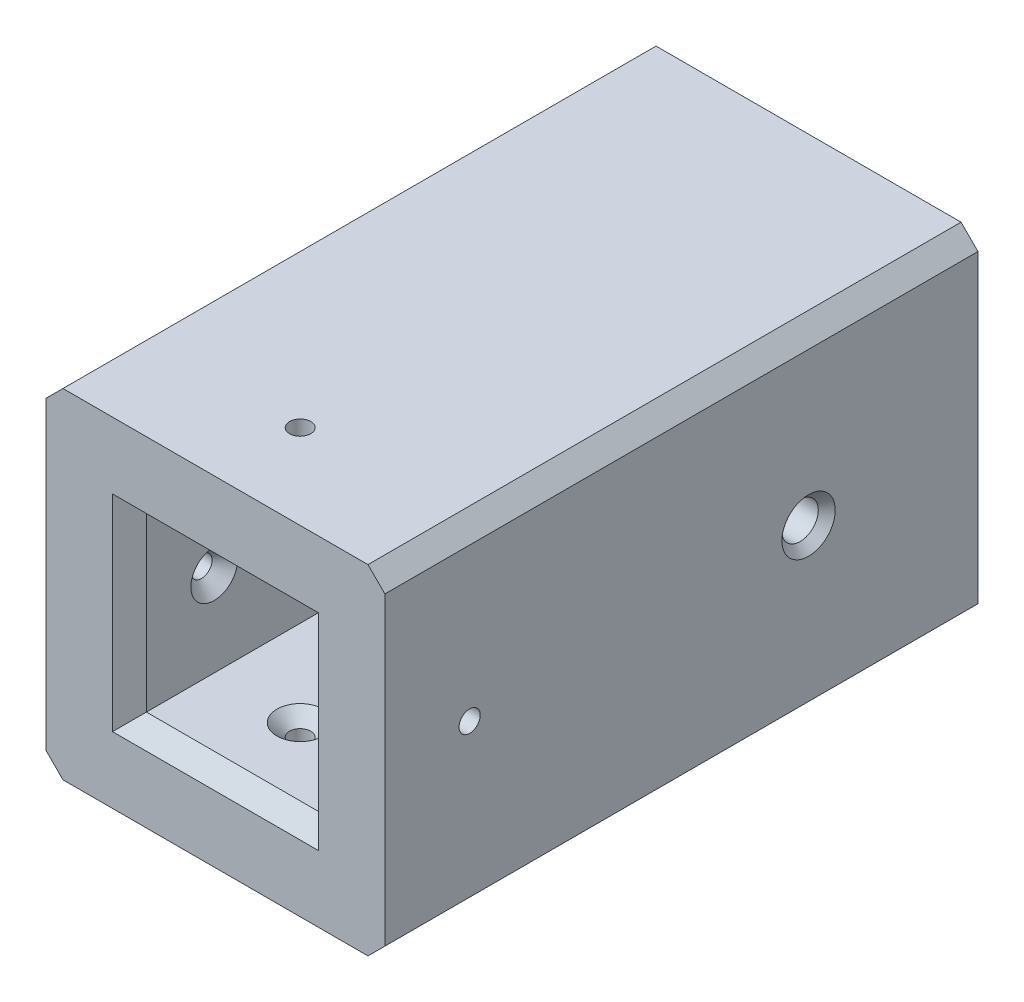
from build123d import *

# Parameters (mm, degrees)
SKETCH_2_W          = 40
SKETCH_2_H          = 40
SKETCH_2_W_2        = 20.3
SKETCH_2_H_2        = 20.3
EXTRUDE_1_DEPTH     = 94
CHAMFER_1_SIZE      = 2
CHAMFER_2_SIZE      = 2
SKETCH_5_R          = 1.25
CUT_EXTRUDE_2_DEPTH = 48
SKETCH_7_R          = 2.15
CUT_EXTRUDE_4_DEPTH = 79
CHAMFER_6_SIZE      = 1
SKETCH_8_W          = 65.895062616
SKETCH_8_H          = 54.143076927
CUT_EXTRUDE_5_DEPTH = 24
SKETCH_9_R          = 1.25
CUT_EXTRUDE_6_DEPTH = 49
CHAMFER_7_SIZE      = 1.5
CHAMFER_8_SIZE      = 2


with BuildPart() as part:
    # 草图2 → 凸台-拉伸1 (new body)
    with BuildSketch(Plane.XY):
        with Locations((20, 20)):
            Rectangle(SKETCH_2_W, SKETCH_2_H)
        with Locations((20, 20)):
            Rectangle(SKETCH_2_W_2, SKETCH_2_H_2, mode=Mode.SUBTRACT)
    extrude(amount=EXTRUDE_1_DEPTH)

    # 倒角1
    chamfer_1_edges = [part.edges().sort_by_distance(p)[0] for p in [
        (9.85, 20, 94),
        (20, 9.85, 94),
        (30.15, 20, 94),
        (20, 30.15, 94),
    ]]
    chamfer(chamfer_1_edges, length=CHAMFER_1_SIZE)

    # 倒角2
    chamfer_2_edges = [part.edges().sort_by_distance(p)[0] for p in [
        (0, 40, 47),
        (40, 40, 47),
        (40, 0, 47),
        (0, 0, 47),
    ]]
    chamfer(chamfer_2_edges, length=CHAMFER_2_SIZE)

    # 草图5 → 切除-拉伸2 (cut)
    with BuildSketch(Plane.XZ):
        with Locations(Location((20, 84, 0), (0, 0, 270))):
            Circle(SKETCH_5_R)
    extrude(amount=-CUT_EXTRUDE_2_DEPTH, mode=Mode.SUBTRACT)

    # 草图7 → 切除-拉伸4 (cut)
    with BuildSketch(Plane(origin=(40, 0, 0), x_dir=(0, 0, -1), z_dir=(1, 0, 0))):
        with Locations((-44, 20)):
            Circle(SKETCH_7_R)
    extrude(amount=-CUT_EXTRUDE_4_DEPTH, mode=Mode.SUBTRACT)

    # 倒角6
    chamfer_6_edges = [part.edges().sort_by_distance(p)[0] for p in [
        (0, 20, 46.15),
        (40, 20, 46.15),
    ]]
    chamfer(chamfer_6_edges, length=CHAMFER_6_SIZE)

    # 草图8 → 切除-拉伸5 (cut)
    with BuildSketch(Plane(origin=(0, 0, 0), x_dir=(-1, 0, 0), z_dir=(0, 0, -1))):
        with Locations((-18.489087128, 17.145946332)):
            Rectangle(SKETCH_8_W, SKETCH_8_H)
    extrude(amount=-CUT_EXTRUDE_5_DEPTH, mode=Mode.SUBTRACT)

    # 草图9 → 切除-拉伸6 (cut)
    with BuildSketch(Plane.ZY):
        with Locations((84, 20)):
            Circle(SKETCH_9_R)
    extrude(amount=-CUT_EXTRUDE_6_DEPTH, mode=Mode.SUBTRACT)

    # 倒角7
    chamfer_7_edges = [part.edges().sort_by_distance(p)[0] for p in [
        (30.15, 20, 82.75),
        (9.85, 20, 82.75),
        (20, 30.15, 85.25),
        (20, 9.85, 85.25),
    ]]
    chamfer(chamfer_7_edges, length=CHAMFER_7_SIZE)

    # 倒角8
    chamfer_8_edges = [part.edges().sort_by_distance(p)[0] for p in [
        (20, 9.85, 24),
        (9.85, 20, 24),
        (20, 30.15, 24),
        (30.15, 20, 24),
    ]]
    chamfer(chamfer_8_edges, length=CHAMFER_8_SIZE)


solid = part.part
